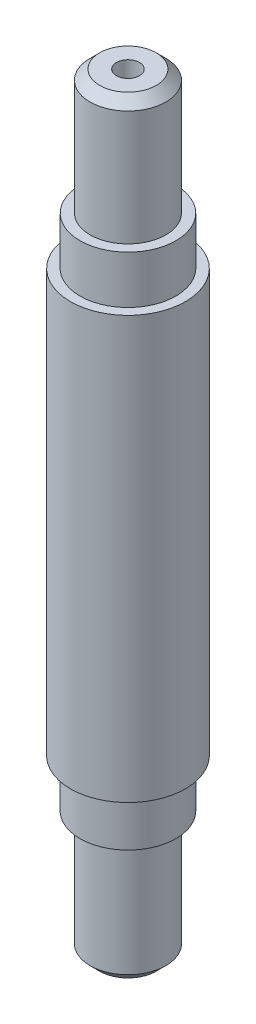
from build123d import *

# Parameters (mm, degrees)
SKETCH4_R           = 3.95
BOSS_EXTRUDE2_DEPTH = 18
CUT_EXTRUDE2_START  = 15.5
SKETCH4_3_R         = 1.2
CUT_EXTRUDE2_DEPTH  = 2.5
SKETCH4_4_R         = 5
SKETCH4_4_R_2       = 3.95
BOSS_EXTRUDE3_DEPTH = 5
SKETCH4_5_R         = 6
BOSS_EXTRUDE4_DEPTH = 44
BOSS_EXTRUDE8_START = -49
SKETCH4_10_R        = 5
BOSS_EXTRUDE8_DEPTH = 49
BOSS_EXTRUDE9_START = -62
SKETCH4_11_R        = 3.95
BOSS_EXTRUDE9_DEPTH = 62
CUT_EXTRUDE3_START  = -59.5
SKETCH4_13_R        = 1.2
CUT_EXTRUDE3_DEPTH  = 4.077951389
CHAMFER3_SIZE       = 1


with BuildPart() as part:
    # Sketch4 → Boss-Extrude2 (new body)
    with BuildSketch(Plane(origin=(0, 0, 0), x_dir=(1, 0, 0), z_dir=(0, 1, 0))):
        Circle(SKETCH4_R)
    extrude(amount=BOSS_EXTRUDE2_DEPTH)

    # Sketch4<3> → Cut-Extrude2 (cut)
    with BuildSketch(Plane(origin=(0, 0, 0), x_dir=(1, 0, 0), z_dir=(0, 1, 0)).offset(CUT_EXTRUDE2_START)):
        Circle(SKETCH4_3_R)
    extrude(amount=CUT_EXTRUDE2_DEPTH, mode=Mode.SUBTRACT)

    # Sketch4<4> → Boss-Extrude3 (add)
    with BuildSketch(Plane(origin=(0, 0, 0), x_dir=(1, 0, 0), z_dir=(0, 1, 0))):
        Circle(SKETCH4_4_R)
        Circle(SKETCH4_4_R_2, mode=Mode.SUBTRACT)
    extrude(amount=BOSS_EXTRUDE3_DEPTH)

    # Sketch4<5> → Boss-Extrude4 (add)
    with BuildSketch(Plane(origin=(0, 0, 0), x_dir=(1, 0, 0), z_dir=(0, 1, 0))):
        Circle(SKETCH4_5_R)
    extrude(amount=-BOSS_EXTRUDE4_DEPTH)

    # Sketch4<10> → Boss-Extrude8 (add)
    with BuildSketch(Plane(origin=(0, 0, 0), x_dir=(1, 0, 0), z_dir=(0, 1, 0)).offset(BOSS_EXTRUDE8_START)):
        Circle(SKETCH4_10_R)
    extrude(amount=BOSS_EXTRUDE8_DEPTH)

    # Sketch4<11> → Boss-Extrude9 (add)
    with BuildSketch(Plane(origin=(0, 0, 0), x_dir=(1, 0, 0), z_dir=(0, 1, 0)).offset(BOSS_EXTRUDE9_START)):
        Circle(SKETCH4_11_R)
    extrude(amount=BOSS_EXTRUDE9_DEPTH)

    # Sketch4<13> → Cut-Extrude3 (cut, through all)
    with BuildSketch(Plane(origin=(0, 0, 0), x_dir=(1, 0, 0), z_dir=(0, 1, 0)).offset(CUT_EXTRUDE3_START)):
        Circle(SKETCH4_13_R)
    extrude(amount=-CUT_EXTRUDE3_DEPTH, mode=Mode.SUBTRACT)

    # Chamfer3
    chamfer3_edges = [part.edges().sort_by_distance(p)[0] for p in [
        (-3.95, 18, 0),
        (-3.95, -62, 0),
    ]]
    chamfer(chamfer3_edges, length=CHAMFER3_SIZE)


solid = part.part
